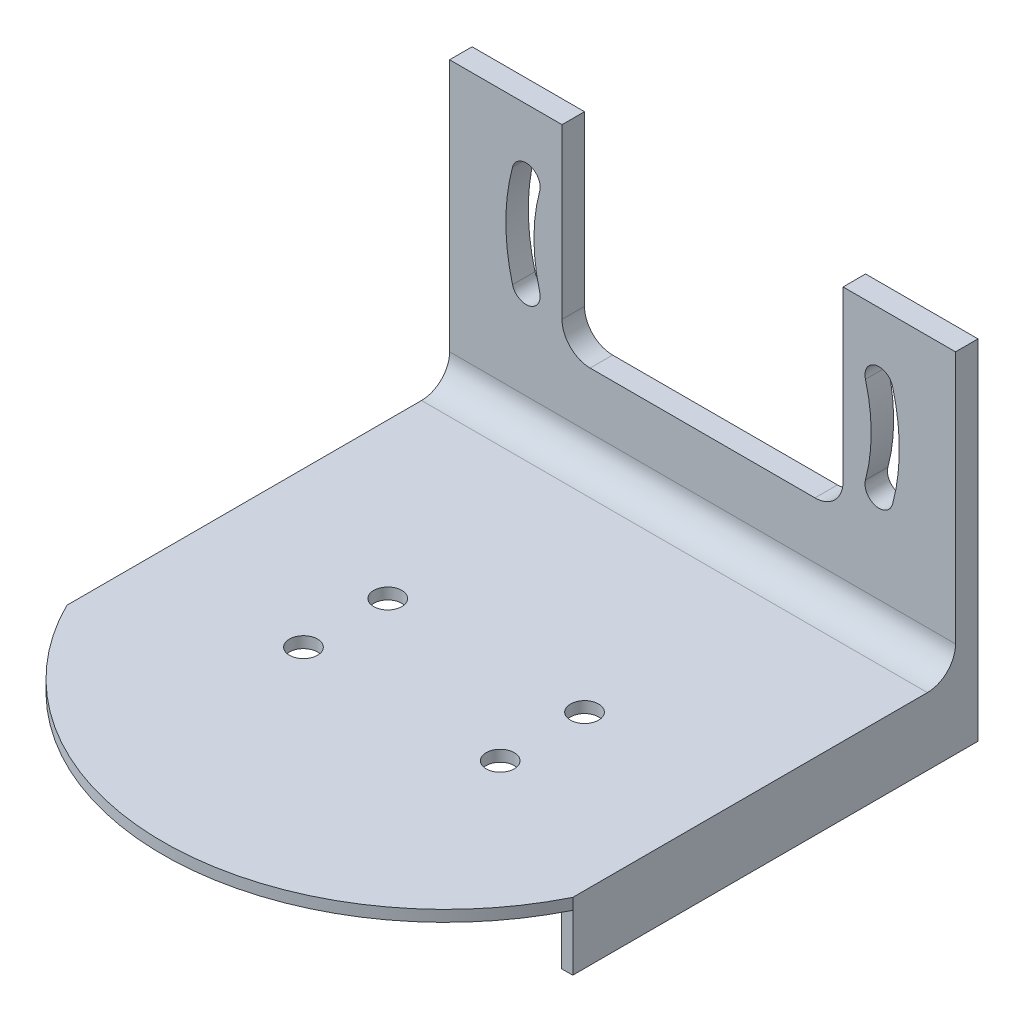
from build123d import *

# Parameters (mm, degrees)
SKETCH1_W                = 200
SKETCH1_H                = 100
BOSS_EXTRUDE1_DEPTH      = 2
BOSS_EXTRUDE2_DEPTH      = 50
CUT_EXTRUDE6_DEPTH       = 50
CUT_EXTRUDE7_DEPTH       = 50
SKETCH9_R                = 2.5
CUT_EXTRUDE8_DEPTH       = 20
CUT_EXTRUDE20_DEPTH      = 123.474487139
CUT_EXTRUDE20_DEPTH_BACK = 123.474487139
BOSS_EXTRUDE5_DEPTH      = 90
CUT_EXTRUDE28_DEPTH      = 84.815273071
CUT_EXTRUDE28_DEPTH_BACK = 84.815273071
SKETCH25_W               = 2
SKETCH25_H               = 72.093516731
BOSS_EXTRUDE7_DEPTH      = 10


with BuildPart() as part:
    # Sketch1 → Boss-Extrude1 (new body)
    with BuildSketch(Plane(origin=(0, 0, 0), x_dir=(1, 0, 0), z_dir=(0, 1, 0))):
        Rectangle(SKETCH1_W, SKETCH1_H)
    extrude(amount=BOSS_EXTRUDE1_DEPTH)

    # Sketch3 → Boss-Extrude2 (add)
    with BuildSketch(Plane(origin=(0, 2, 0), x_dir=(1, 0, 0), z_dir=(0, 1, 0))):
        Polygon((0, 50), (-45, 50), (-45, 46), (45, 46), (45, 50), align=None)
    extrude(amount=BOSS_EXTRUDE2_DEPTH)

    # Sketch4 → Cut-Extrude6 (cut)
    with BuildSketch(Plane(origin=(0, 0, -50), x_dir=(-1, 0, 0), z_dir=(0, 0, -1))):
        with BuildLine():
            Line((25, 52), (25, 22))
            ThreePointArc((25, 22), (23.535533906, 18.464466094), (20, 17))
            Line((20, 17), (-20, 17))
            ThreePointArc((-20, 17), (-23.535533906, 18.464466094), (-25, 22))
            Line((-25, 22), (-25, 52))
            Line((-25, 52), (25, 52))
        make_face()
    extrude(amount=-CUT_EXTRUDE6_DEPTH, mode=Mode.SUBTRACT)

    # Sketch5 → Cut-Extrude7 (cut)
    with BuildSketch(Plane(origin=(0, 0, -50), x_dir=(-1, 0, 0), z_dir=(0, 0, -1))):
        with BuildLine():
            ThreePointArc((-28.977774789, 39.764571353), (-30, 32), (-28.977774789, 24.235428647))
            ThreePointArc((-28.977774789, 24.235428647), (-30.745541742, 21.173566468), (-33.80740392, 22.941333421))
            ThreePointArc((-33.80740392, 22.941333421), (-35, 32), (-33.80740392, 41.058666579))
            ThreePointArc((-33.80740392, 41.058666579), (-30.745541742, 42.826433532), (-28.977774789, 39.764571353))
        make_face()
        with BuildLine():
            ThreePointArc((28.977774789, 24.235428647), (30.745541742, 21.173566468), (33.80740392, 22.941333421))
            ThreePointArc((33.80740392, 22.941333421), (35, 32), (33.80740392, 41.058666579))
            ThreePointArc((33.80740392, 41.058666579), (30.745541742, 42.826433532), (28.977774789, 39.764571353))
            ThreePointArc((28.977774789, 39.764571353), (30, 32), (28.977774789, 24.235428647))
        make_face()
    extrude(amount=-CUT_EXTRUDE7_DEPTH, mode=Mode.SUBTRACT)

    # Sketch9 → Cut-Extrude8 (cut)
    with BuildSketch(Plane(origin=(0, 2, 0), x_dir=(1, 0, 0), z_dir=(0, 1, 0))):
        with Locations(Location((-17.5, 7.5, 0), (0, 0, 270))):
            Circle(SKETCH9_R)
        with Locations(Location((17.5, 7.5, 0), (0, 0, 90))):
            Circle(SKETCH9_R)
        with Locations(Location((17.5, -7.5, 0), (0, 0, 270))):
            Circle(SKETCH9_R)
        with Locations(Location((-17.5, -7.5, 0), (0, 0, 90))):
            Circle(SKETCH9_R)
    extrude(amount=-CUT_EXTRUDE8_DEPTH, mode=Mode.SUBTRACT)

    # Sketch17 → Cut-Extrude20 (cut, two sides: drawn at the far end of the back side and taken through both)
    with BuildSketch(Plane(origin=(0, 2, 0), x_dir=(1, 0, 0), z_dir=(0, 1, 0)).offset(-CUT_EXTRUDE20_DEPTH_BACK)):
        Polygon((-45, 46), (-45, 50), (-100, 50), (-100, -50), (-45, -50), align=None)
        Polygon((45, 50), (45, 46), (45, -50), (100, -50), (100, 50), align=None)
    extrude(amount=CUT_EXTRUDE20_DEPTH + CUT_EXTRUDE20_DEPTH_BACK, mode=Mode.SUBTRACT)

    # Sketch18 → Boss-Extrude5 (add)
    with BuildSketch(Plane.ZY.offset(45)):
        with BuildLine():
            Line((-46, 7), (-46, 2))
            Line((-46, 2), (-41, 2))
            ThreePointArc((-41, 2), (-44.535533906, 3.464466094), (-46, 7))
        make_face()
    extrude(amount=-BOSS_EXTRUDE5_DEPTH)

    # Sketch24 → Cut-Extrude28 (cut, two sides: drawn at the far end of the back side and taken through both)
    with BuildSketch(Plane(origin=(0, 2, 0), x_dir=(1, 0, 0), z_dir=(0, 1, 0)).offset(-CUT_EXTRUDE28_DEPTH_BACK)):
        with BuildLine():
            Line((-151.955597575, 193.459233006), (-45, -22.093516731))
            ThreePointArc((-45, -22.093516731), (0, -50), (45, -22.093516731))
            Line((45, -22.093516731), (151.955597575, 193.459233006))
            Line((151.955597575, 193.459233006), (151.955597575, -287.79948233))
            Line((151.955597575, -287.79948233), (-151.955597575, -287.79948233))
            Line((-151.955597575, -287.79948233), (-151.955597575, 193.459233006))
        make_face()
    extrude(amount=CUT_EXTRUDE28_DEPTH + CUT_EXTRUDE28_DEPTH_BACK, mode=Mode.SUBTRACT)

    # Sketch25 → Boss-Extrude7 (add)
    with BuildSketch(Plane.XZ):
        with Locations((-44, -13.953241634)):
            Rectangle(SKETCH25_W, SKETCH25_H)
        with Locations((44, -13.953241634)):
            Rectangle(SKETCH25_W, SKETCH25_H)
    extrude(amount=BOSS_EXTRUDE7_DEPTH)


solid = part.part
